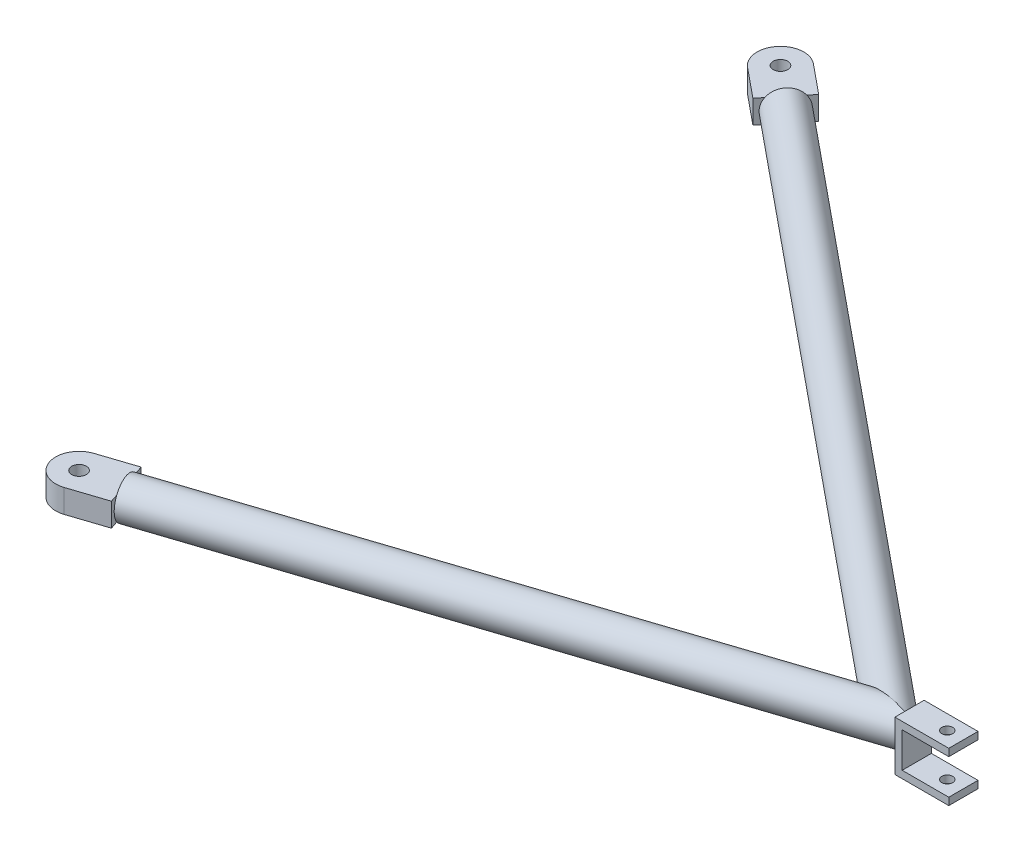
from build123d import *

# Parameters (mm, degrees)
SKETCH2_R                      = 8.255
BOSS_EXTRUDE1_DEPTH            = 8.89
BOSS_EXTRUDE1_DEPTH_BACK       = 3.81
BOSS_EXTRUDE2_DEPTH            = 10.16
BOSS_EXTRUDE2_DEPTH_BACK       = 16.256
SKETCH4_W                      = 20.32
SKETCH4_H                      = 10.16
BOSS_EXTRUDE3_DEPTH            = 10.16
BOSS_EXTRUDE3_DEPTH_BACK       = 16.51
SKETCH5_W                      = 20.32
SKETCH5_H                      = 10.16
CUT_EXTRUDE1_DEPTH             = 364.372587018
CUT_EXTRUDE2_DEPTH             = 360.616172571
CUT_EXTRUDE3_START             = -16.256
CUT_EXTRUDE3_DEPTH             = 16.256
CUT_EXTRUDE4_DEPTH             = 16.51
E_0_25_DIAMETER_HOLE1_D        = 6.35
E_0_25_DIAMETER_HOLE1_DEPTH    = 19.05
E_0_25_DIAMETER_HOLE1_TIP      = 1.907732465
F_3_16_0_1875_DIAMETER_HOLE1_D = 4.7625
CUT_EXTRUDE5_DEPTH             = 364.084786631


with BuildPart() as part:
    # Sweep1: sweep along a path in Sketch1
    with BuildLine(Plane(origin=(0, 0, 0), x_dir=(1, 0, 0), z_dir=(0, 1, 0))) as sweep1_path:
        Line((-265.319834303, -87.577083333), (0, 0))
        Line((0, 0), (-265.319834303, 217.222916667))
    # Sketch2 → Sweep1 (sweep)
    with BuildSketch(Plane(origin=(-265.319834303, 0, 87.577083333), x_dir=(-0.3134469696969697, 0, -0.949605706168506), z_dir=(0.949605706168506, 0, -0.3134469696969697))):
        Circle(SKETCH2_R)
    sweep(path=sweep1_path.line, transition=Transition.RIGHT)

    # Sketch3 → Boss-Extrude1 (add, two sides: drawn at the far end of the back side and taken through both)
    with BuildSketch(Plane.XY.offset(-BOSS_EXTRUDE1_DEPTH_BACK)):
        Polygon((33.931753368, 10.795), (10.503958333, 10.795), (10.503958333, -10.795), (33.931753368, -10.795), (33.931753368, -7.62), (13.678958333, -7.62), (13.678958333, 7.62), (33.931753368, 7.62), align=None)
    extrude(amount=BOSS_EXTRUDE1_DEPTH + BOSS_EXTRUDE1_DEPTH_BACK)

    # Sketch4 → Boss-Extrude2 (add, two sides: drawn at the far end of the back side and taken through both)
    with BuildSketch(Plane(origin=(-265.319834303, 0, 87.577083333), x_dir=(0.3134469696969697, 0, 0.949605706168506), z_dir=(-0.949605706168506, 0, 0.3134469696969697)).offset(-BOSS_EXTRUDE2_DEPTH_BACK)):
        Rectangle(SKETCH4_W, SKETCH4_H)
    extrude(amount=BOSS_EXTRUDE2_DEPTH + BOSS_EXTRUDE2_DEPTH_BACK)

    # Sketch5 → Boss-Extrude3 (add, two sides: drawn at the far end of the back side and taken through both)
    with BuildSketch(Plane(origin=(-265.319834303, 0, -217.222916667), x_dir=(-0.633487654320988, 0, 0.7737527976187824), z_dir=(-0.7737527976187824, 0, -0.633487654320988)).offset(-BOSS_EXTRUDE3_DEPTH_BACK)):
        Rectangle(SKETCH5_W, SKETCH5_H)
    extrude(amount=BOSS_EXTRUDE3_DEPTH + BOSS_EXTRUDE3_DEPTH_BACK)

    # Sketch6 → Cut-Extrude1 (cut, through all)
    with BuildSketch(Plane(origin=(0, 5.08, 0), x_dir=(1, 0, 0), z_dir=(0, 1, 0))):
        with BuildLine():
            Line((-271.756068871, 209.361588243), (-279.617397295, 215.797822811))
            Line((-279.617397295, 215.797822811), (-273.181162727, 223.659151235))
            ThreePointArc((-273.181162727, 223.659151235), (-275.429738049, 216.215223137), (-271.756068871, 209.361588243))
        make_face()
    cut_extrude1 = extrude(amount=-CUT_EXTRUDE1_DEPTH, mode=Mode.SUBTRACT)

    # Mirror1: Cut-Extrude1 across plane
    add(cut_extrude1.mirror(Plane(origin=(0, 0, 0), x_dir=(0.7737527976187827, 0, 0.6334876543209876), z_dir=(-0.633487654320988, 0, 0.7737527976187826))), mode=Mode.SUBTRACT)

    # Sketch7 → Cut-Extrude2 (cut, through all)
    with BuildSketch(Plane(origin=(0, 5.08, 0), x_dir=(1, 0, 0), z_dir=(0, 1, 0))):
        with BuildLine():
            Line((-262.135213091, -97.225077308), (-271.783207066, -100.40969852))
            Line((-271.783207066, -100.40969852), (-274.967828278, -90.761704545))
            ThreePointArc((-274.967828278, -90.761704545), (-269.890129013, -96.651112552), (-262.135213091, -97.225077308))
        make_face()
    cut_extrude2 = extrude(amount=-CUT_EXTRUDE2_DEPTH, mode=Mode.SUBTRACT)

    # Mirror2: Cut-Extrude2 across plane
    add(cut_extrude2.mirror(Plane(origin=(0, 0, 0), x_dir=(0.9496057061685059, 0, -0.3134469696969697), z_dir=(0.3134469696969697, 0, 0.949605706168506))), mode=Mode.SUBTRACT)

    # Sketch8 → Cut-Extrude3 (cut)
    with BuildSketch(Plane(origin=(-265.319834303, 0, 87.577083333), x_dir=(0.3134469696969697, 0, 0.949605706168506), z_dir=(-0.949605706168506, 0, 0.3134469696969697)).offset(CUT_EXTRUDE3_START)):
        with BuildLine():
            Line((6.506813736, -5.08), (-6.506813736, -5.08))
            ThreePointArc((-6.506813736, -5.08), (0, -8.255), (6.506813736, -5.08))
        make_face()
        with BuildLine():
            Line((-6.506813736, 5.08), (6.506813736, 5.08))
            ThreePointArc((6.506813736, 5.08), (0, 8.255), (-6.506813736, 5.08))
        make_face()
    extrude(amount=CUT_EXTRUDE3_DEPTH, mode=Mode.SUBTRACT)

    # Sketch9 → Cut-Extrude4 (cut)
    with BuildSketch(Plane(origin=(-265.319834303, 0, -217.222916667), x_dir=(-0.633487654320988, 0, 0.7737527976187824), z_dir=(-0.7737527976187824, 0, -0.633487654320988))):
        with BuildLine():
            Line((6.506813736, -5.08), (-6.506813736, -5.08))
            ThreePointArc((-6.506813736, -5.08), (0, -8.255), (6.506813736, -5.08))
        make_face()
        with BuildLine():
            Line((-6.506813736, 5.08), (6.506813736, 5.08))
            ThreePointArc((6.506813736, 5.08), (0, 8.255), (-6.506813736, 5.08))
        make_face()
    extrude(amount=-CUT_EXTRUDE4_DEPTH, mode=Mode.SUBTRACT)

    # E (0.25) Diameter Hole1
    with Locations(Plane(origin=(-265.319834303, 5.08, -217.222916667), x_dir=(0, 0, 1), z_dir=(0, 1, 0))):
        with Locations((0, 0), (304.8, 0)):
            Hole(E_0_25_DIAMETER_HOLE1_D / 2, depth=E_0_25_DIAMETER_HOLE1_DEPTH)
            with Locations((0, 0, -(E_0_25_DIAMETER_HOLE1_DEPTH + E_0_25_DIAMETER_HOLE1_TIP / 2))):  # 118° drill point
                Cone(0, E_0_25_DIAMETER_HOLE1_D / 2, E_0_25_DIAMETER_HOLE1_TIP, mode=Mode.SUBTRACT)

    # 3/16 (0.1875) Diameter Hole1 (through all)
    with Locations(Plane(origin=(0, 10.795, 0), x_dir=(1, 0, 0), z_dir=(0, 1, 0))):
        with Locations((26.933488785, -2.54)):
            Hole(F_3_16_0_1875_DIAMETER_HOLE1_D / 2)

    # Sketch14 → Cut-Extrude5 (cut, through all)
    with BuildSketch(Plane.XY.offset(8.89)):
        with BuildLine():
            Line((13.678958333, 4.822488189), (13.678958333, -4.822488189))
            add(Edge.make_bspline(
                [(13.678958333, -4.822488189), (20.76590224, 0), (13.678958333, 4.822488189)],
                knots=[5.659303655, 5.659303655, 5.659303655, 6.907066959, 6.907066959, 6.907066959], degree=2, weights=[1, 0.811616954, 1]))
        make_face()
    extrude(amount=-CUT_EXTRUDE5_DEPTH, mode=Mode.SUBTRACT)


solid = part.part
